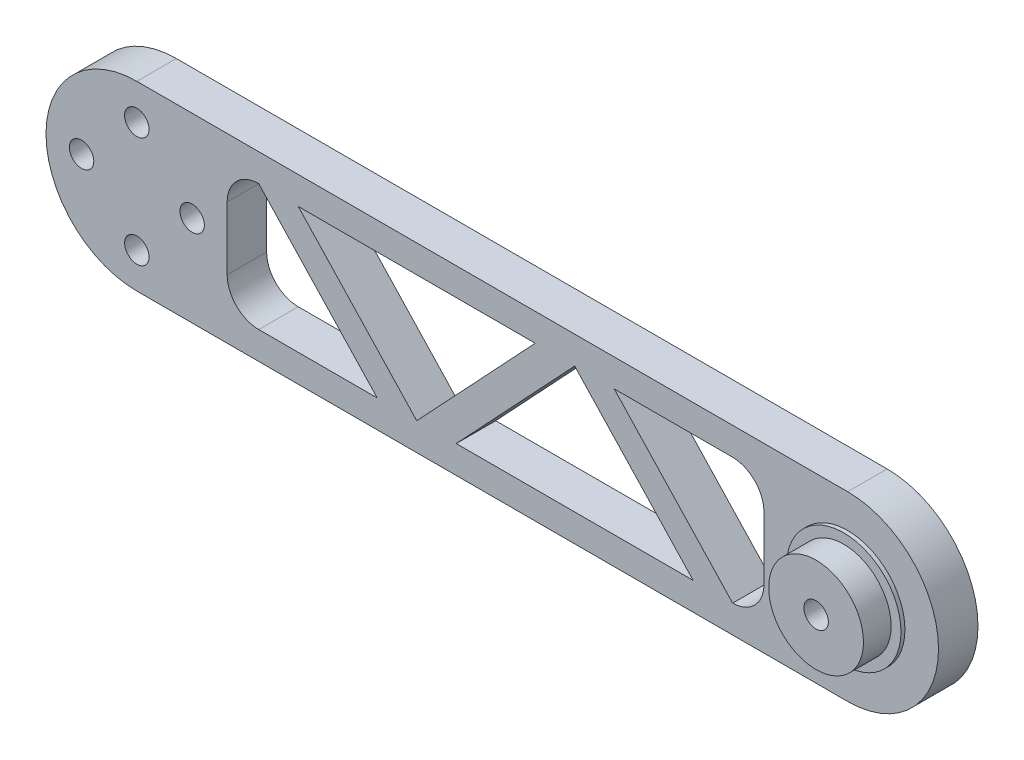
from build123d import *

# Parameters (mm, degrees)
BOSS_EXTRUDE1_DEPTH = 5
SKETCH11_R          = 7.25
BOSS_EXTRUDE3_DEPTH = 0.5
SKETCH12_R          = 6
BOSS_EXTRUDE4_DEPTH = 3.5
SKETCH13_R          = 1.55
CUT_EXTRUDE1_DEPTH  = 20.5
CUT_EXTRUDE2_DEPTH  = 2.6
SKETCH16_R          = 2.85
CUT_EXTRUDE3_DEPTH  = 3.02
SKETCH17_R          = 1.55
CUT_EXTRUDE4_DEPTH  = 10.02
CUT_EXTRUDE13_DEPTH = 10


with BuildPart() as part:
    # Sketch2 → Boss-Extrude1 (new body)
    with BuildSketch(Plane.XY):
        with BuildLine():
            Line((0, 11.5), (90, 11.5))
            ThreePointArc((90, 11.5), (101.5, 0), (90, -11.5))
            Line((90, -11.5), (0, -11.5))
            ThreePointArc((0, -11.5), (-11.5, 0), (0, 11.5))
        make_face()
    extrude(amount=-BOSS_EXTRUDE1_DEPTH)

    # Sketch11 → Boss-Extrude3 (add)
    with BuildSketch(Plane.XY):
        with Locations((90, 0)):
            Circle(SKETCH11_R)
    extrude(amount=BOSS_EXTRUDE3_DEPTH)

    # Sketch12 → Boss-Extrude4 (add)
    with BuildSketch(Plane.XY.offset(0.5)):
        with Locations((90, 0)):
            Circle(SKETCH12_R)
    extrude(amount=BOSS_EXTRUDE4_DEPTH)

    # Sketch13 → Cut-Extrude1 (cut)
    with BuildSketch(Plane.XY.offset(4)):
        with Locations((90, 0)):
            Circle(SKETCH13_R)
    extrude(amount=-CUT_EXTRUDE1_DEPTH, mode=Mode.SUBTRACT)

    # Sketch14 → Cut-Extrude2 (cut)
    with BuildSketch(Plane(origin=(0, 0, -5), x_dir=(-1, 0, 0), z_dir=(0, 0, -1))):
        Polygon((-93.213605432, -0.355068252), (-91.299304589, -2.960598068), (-88.085699158, -2.605529815), (-86.786394568, 0.355068252), (-88.700695411, 2.960598068), (-91.914300842, 2.605529815), align=None)
    extrude(amount=-CUT_EXTRUDE2_DEPTH, mode=Mode.SUBTRACT)

    # Sketch16 → Cut-Extrude3 (cut)
    with BuildSketch(Plane(origin=(0, 0, -5), x_dir=(-1, 0, 0), z_dir=(0, 0, -1))):
        Circle(SKETCH16_R)
    extrude(amount=-CUT_EXTRUDE3_DEPTH, mode=Mode.SUBTRACT)

    # Sketch17 → Cut-Extrude4 (cut)
    with BuildSketch(Plane.XY):
        with Locations((0, 7)):
            Circle(SKETCH17_R)
        with Locations((0, -7)):
            Circle(SKETCH17_R)
        with Locations((-7, 0)):
            Circle(SKETCH17_R)
        with Locations((7, 0)):
            Circle(SKETCH17_R)
    extrude(amount=-CUT_EXTRUDE4_DEPTH, mode=Mode.SUBTRACT)

    # Sketch18 → Cut-Extrude13 (cut)
    with BuildSketch(Plane.XY):
        Polygon((50.43728363, 8), (20.43728363, 8), (35.43728363, -8), align=None)
        with BuildLine():
            Line((30.43728363, -8), (15.43728363, 8))
            ThreePointArc((15.43728363, 8), (12.608856505, 6.828427125), (11.43728363, 4))
            Line((11.43728363, 4), (11.43728363, -4))
            ThreePointArc((11.43728363, -4), (12.608856505, -6.828427125), (15.43728363, -8))
            Line((15.43728363, -8), (30.43728363, -8))
        make_face()
        Polygon((70.43728363, -8), (55.43728363, 8), (40.43728363, -8), align=None)
        with BuildLine():
            Line((75.396348206, 8), (60.43728363, 8))
            Line((60.43728363, 8), (75.43728363, -8))
            ThreePointArc((75.43728363, -8), (78.239211349, -6.814126517), (79.396348206, -4.000209469))
            Line((79.396348206, -4.000209469), (79.396348206, 4))
            ThreePointArc((79.396348206, 4), (78.224775331, 6.828427125), (75.396348206, 8))
        make_face()
    extrude(amount=-CUT_EXTRUDE13_DEPTH, mode=Mode.SUBTRACT)


solid = part.part
